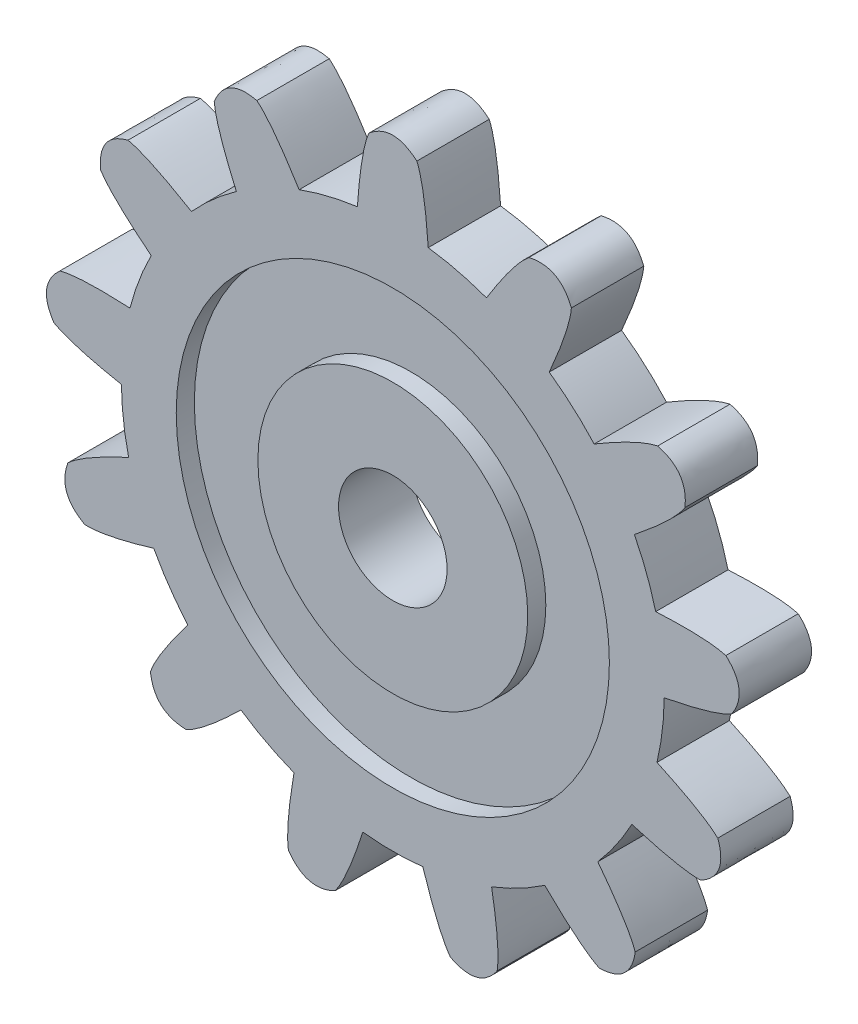
from build123d import *

# Parameters (mm, degrees)
SKETCH1_R           = 7.62
BOSS_EXTRUDE2_DEPTH = 10.16
SKETCH2_R           = 30.48
SKETCH2_R_2         = 19.05
CUT_EXTRUDE1_DEPTH  = 2.54
SKETCH4_R           = 30.401229143
SKETCH4_R_2         = 18.940015454
CUT_EXTRUDE3_DEPTH  = 2.54


with BuildPart() as part:
    # Sketch1 → Boss-Extrude2 (new body)
    with BuildSketch(Plane.XY):
        with BuildLine():
            ThreePointArc((-4.973047924, 37.774049218), (-9.117926809, 36.992883244), (-13.151060724, 35.758350099))
            add(Edge.make_bspline(
                [(-19.084474431, 43.633182282), (-16.926977066, 41.864131326), (-13.151060724, 35.758350099)],
                knots=[0, 0, 0, 1, 1, 1], degree=2))
            add(Edge.make_bspline(
                [(-25.068187902, 40.492687188), (-23.423529412, 44.629806533), (-19.084474431, 43.633182282)],
                knots=[0, 0, 0, 1, 1, 1], degree=2))
            add(Edge.make_bspline(
                [(-25.068187902, 40.492687188), (-24.837885701, 37.712166182), (-21.957891223, 31.136168888)],
                knots=[0, 0, 0, 1, 1, 1], degree=2))
            ThreePointArc((-21.957891223, 31.136168888), (-25.264973279, 28.518259505), (-28.262419847, 25.550843908))
            add(Edge.make_bspline(
                [(-37.175813758, 29.766266676), (-34.443325744, 29.202488866), (-28.262419847, 25.550843908)],
                knots=[0, 0, 0, 1, 1, 1], degree=2))
            add(Edge.make_bspline(
                [(-41.014668065, 24.204726066), (-41.481010519, 28.63227423), (-37.175813758, 29.766266676)],
                knots=[0, 0, 0, 1, 1, 1], degree=2))
            add(Edge.make_bspline(
                [(-41.014668065, 24.204726066), (-39.518573051, 21.849723757), (-33.912446265, 17.365367497)],
                knots=[0, 0, 0, 1, 1, 1], degree=2))
            ThreePointArc((-33.912446265, 17.365367497), (-35.624118846, 13.510446196), (-36.899199182, 9.489947298))
            add(Edge.make_bspline(
                [(-46.75062217, 9.080258097), (-44.069123581, 9.850908135), (-36.899199182, 9.489947298)],
                knots=[0, 0, 0, 1, 1, 1], degree=2))
            add(Edge.make_bspline(
                [(-47.565182054, 2.371753901), (-50.035692017, 6.075432957), (-46.75062217, 9.080258097)],
                knots=[0, 0, 0, 1, 1, 1], degree=2))
            add(Edge.make_bspline(
                [(-47.565182054, 2.371753901), (-45.146031566, 0.981772936), (-38.098068557, -0.383630312)],
                knots=[0, 0, 0, 1, 1, 1], degree=2))
            ThreePointArc((-38.098068557, -0.383630312), (-37.822208103, -4.592447518), (-37.082816668, -8.744981872))
            add(Edge.make_bspline(
                [(-45.615426449, -13.685928184), (-43.599216296, -11.757396933), (-37.082816668, -8.744981872)],
                knots=[0, 0, 0, 1, 1, 1], degree=2))
            add(Edge.make_bspline(
                [(-43.219086057, -20.0045585), (-47.12779947, -17.87321679), (-45.615426449, -13.685928184)],
                knots=[0, 0, 0, 1, 1, 1], degree=2))
            add(Edge.make_bspline(
                [(-43.219086057, -20.0045585), (-40.431078318, -20.111090232), (-33.555882474, -18.04474304)],
                knots=[0, 0, 0, 1, 1, 1], degree=2))
            ThreePointArc((-33.555882474, -18.04474304), (-31.355685291, -21.64326685), (-28.771207752, -24.976541083))
            add(Edge.make_bspline(
                [(-34.030286254, -33.31683325), (-33.141253985, -30.672224056), (-28.771207752, -24.976541083)],
                knots=[0, 0, 0, 1, 1, 1], degree=2))
            add(Edge.make_bspline(
                [(-28.972018291, -37.798067629), (-33.423496015, -37.727327965), (-34.030286254, -33.31683325)],
                knots=[0, 0, 0, 1, 1, 1], degree=2))
            add(Edge.make_bspline(
                [(-28.972018291, -37.798067629), (-26.453852274, -36.596744994), (-21.326448108, -31.572022601)],
                knots=[0, 0, 0, 1, 1, 1], degree=2))
            ThreePointArc((-21.326448108, -31.572022601), (-17.705952855, -33.735874577), (-13.868461871, -35.486275732))
            add(Edge.make_bspline(
                [(-14.649217588, -45.315253331), (-15.091029782, -42.560414288), (-13.868461871, -35.486275732)],
                knots=[0, 0, 0, 1, 1, 1], degree=2))
            add(Edge.make_bspline(
                [(-8.087810285, -46.932494981), (-12.06227242, -48.938562968), (-14.649217588, -45.315253331)],
                knots=[0, 0, 0, 1, 1, 1], degree=2))
            add(Edge.make_bspline(
                [(-8.087810285, -46.932494981), (-6.416367478, -44.698526515), (-4.211381492, -37.866532267)],
                knots=[0, 0, 0, 1, 1, 1], degree=2))
            ThreePointArc((-4.211381492, -37.866532267), (0, -38.1), (4.211381492, -37.866532267))
            add(Edge.make_bspline(
                [(8.087810285, -46.932494981), (6.416367478, -44.698526515), (4.211381492, -37.866532267)],
                knots=[0, 0, 0, 1, 1, 1], degree=2))
            add(Edge.make_bspline(
                [(14.649217588, -45.315253331), (12.06227242, -48.938562968), (8.087810285, -46.932494981)],
                knots=[0, 0, 0, 1, 1, 1], degree=2))
            add(Edge.make_bspline(
                [(14.649217588, -45.315253331), (15.091029782, -42.560414288), (13.868461871, -35.486275732)],
                knots=[0, 0, 0, 1, 1, 1], degree=2))
            ThreePointArc((13.868461871, -35.486275732), (17.705952855, -33.735874577), (21.326448108, -31.572022601))
            add(Edge.make_bspline(
                [(28.972018291, -37.798067629), (26.453852274, -36.596744994), (21.326448108, -31.572022601)],
                knots=[0, 0, 0, 1, 1, 1], degree=2))
            add(Edge.make_bspline(
                [(34.030286254, -33.31683325), (33.423496015, -37.727327965), (28.972018291, -37.798067629)],
                knots=[0, 0, 0, 1, 1, 1], degree=2))
            add(Edge.make_bspline(
                [(34.030286254, -33.31683325), (33.141253985, -30.672224056), (28.771207752, -24.976541083)],
                knots=[0, 0, 0, 1, 1, 1], degree=2))
            ThreePointArc((28.771207752, -24.976541083), (31.355685291, -21.64326685), (33.555882474, -18.04474304))
            add(Edge.make_bspline(
                [(43.219086057, -20.0045585), (40.431078318, -20.111090232), (33.555882474, -18.04474304)],
                knots=[0, 0, 0, 1, 1, 1], degree=2))
            add(Edge.make_bspline(
                [(45.615426449, -13.685928184), (47.12779947, -17.87321679), (43.219086057, -20.0045585)],
                knots=[0, 0, 0, 1, 1, 1], degree=2))
            add(Edge.make_bspline(
                [(45.615426449, -13.685928184), (43.599216296, -11.757396933), (37.082816668, -8.744981872)],
                knots=[0, 0, 0, 1, 1, 1], degree=2))
            ThreePointArc((37.082816668, -8.744981872), (37.822208103, -4.592447518), (38.098068557, -0.383630312))
            add(Edge.make_bspline(
                [(47.565182054, 2.371753901), (45.146031566, 0.981772936), (38.098068557, -0.383630312)],
                knots=[0, 0, 0, 1, 1, 1], degree=2))
            add(Edge.make_bspline(
                [(46.75062217, 9.080258097), (50.035692017, 6.075432957), (47.565182054, 2.371753901)],
                knots=[0, 0, 0, 1, 1, 1], degree=2))
            add(Edge.make_bspline(
                [(46.75062217, 9.080258097), (44.069123581, 9.850908135), (36.899199182, 9.489947298)],
                knots=[0, 0, 0, 1, 1, 1], degree=2))
            ThreePointArc((36.899199182, 9.489947298), (35.624118846, 13.510446196), (33.912446265, 17.365367497))
            add(Edge.make_bspline(
                [(41.014668065, 24.204726066), (39.518573051, 21.849723757), (33.912446265, 17.365367497)],
                knots=[0, 0, 0, 1, 1, 1], degree=2))
            add(Edge.make_bspline(
                [(37.175813758, 29.766266676), (41.481010519, 28.63227423), (41.014668065, 24.204726066)],
                knots=[0, 0, 0, 1, 1, 1], degree=2))
            add(Edge.make_bspline(
                [(37.175813758, 29.766266676), (34.443325744, 29.202488866), (28.262419847, 25.550843908)],
                knots=[0, 0, 0, 1, 1, 1], degree=2))
            ThreePointArc((28.262419847, 25.550843908), (25.264973279, 28.518259505), (21.957891223, 31.136168888))
            add(Edge.make_bspline(
                [(25.068187902, 40.492687188), (24.837885701, 37.712166182), (21.957891223, 31.136168888)],
                knots=[0, 0, 0, 1, 1, 1], degree=2))
            add(Edge.make_bspline(
                [(19.084474431, 43.633182282), (23.423529412, 44.629806533), (25.068187902, 40.492687188)],
                knots=[0, 0, 0, 1, 1, 1], degree=2))
            add(Edge.make_bspline(
                [(19.084474431, 43.633182282), (16.926977066, 41.864131326), (13.151060724, 35.758350099)],
                knots=[0, 0, 0, 1, 1, 1], degree=2))
            ThreePointArc((13.151060724, 35.758350099), (9.117926809, 36.992883244), (4.973047924, 37.774049218))
            add(Edge.make_bspline(
                [(3.378887996, 47.504261665), (4.467138065, 44.935205816), (4.973047924, 37.774049218)],
                knots=[0, 0, 0, 1, 1, 1], degree=2))
            add(Edge.make_bspline(
                [(-3.378887996, 47.504261665), (0, 50.403188007), (3.378887996, 47.504261665)],
                knots=[0, 0, 0, 1, 1, 1], degree=2))
            add(Edge.make_bspline(
                [(-3.378887996, 47.504261665), (-4.467138065, 44.935205816), (-4.973047924, 37.774049218)],
                knots=[0, 0, 0, 1, 1, 1], degree=2))
        make_face()
        Circle(SKETCH1_R, mode=Mode.SUBTRACT)
    extrude(amount=BOSS_EXTRUDE2_DEPTH)

    # Sketch2 → Cut-Extrude1 (cut)
    with BuildSketch(Plane(origin=(0, 0, 0), x_dir=(-1, 0, 0), z_dir=(0, 0, -1))):
        Circle(SKETCH2_R)
        Circle(SKETCH2_R_2, mode=Mode.SUBTRACT)
    extrude(amount=-CUT_EXTRUDE1_DEPTH, mode=Mode.SUBTRACT)

    # Sketch4 → Cut-Extrude3 (cut)
    with BuildSketch(Plane.XY.offset(10.16)):
        Circle(SKETCH4_R)
        Circle(SKETCH4_R_2, mode=Mode.SUBTRACT)
    extrude(amount=-CUT_EXTRUDE3_DEPTH, mode=Mode.SUBTRACT)


solid = part.part
